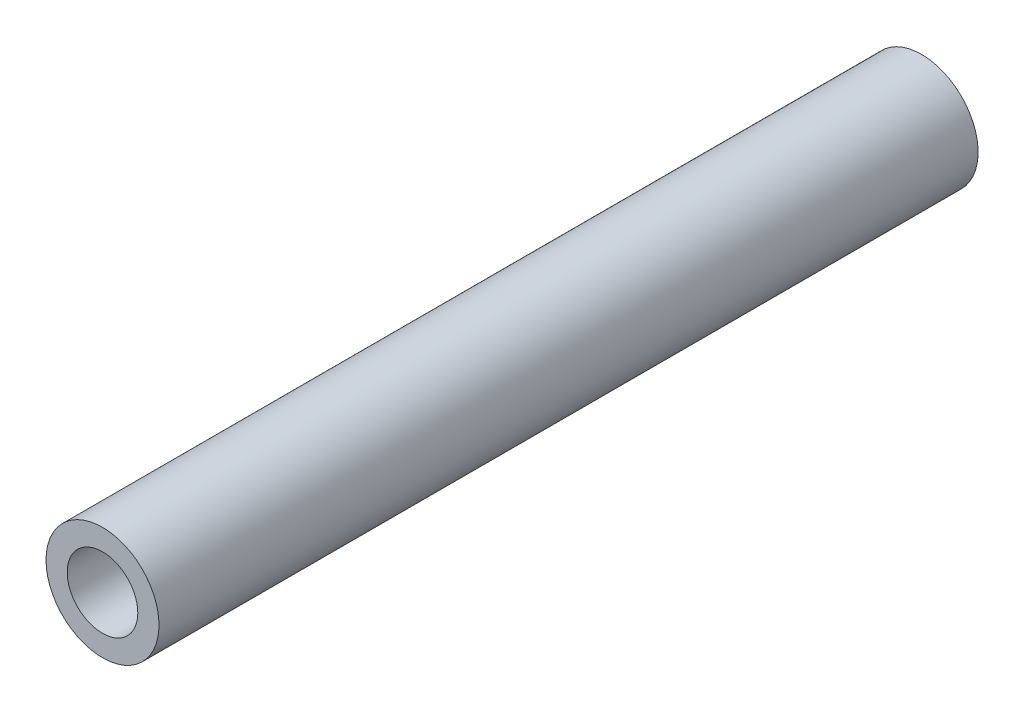
from build123d import *

# Parameters (mm, degrees)
SKETCH1_R           = 2
BOSS_EXTRUDE1_DEPTH = 29


with BuildPart() as part:
    # Sketch1 → Boss-Extrude1 (new body)
    with BuildSketch(Plane.XY):
        with Locations(Location((0, 0, 0), (0, 0, 180))):
            Circle(SKETCH1_R)
    extrude(amount=BOSS_EXTRUDE1_DEPTH)

    # Sketch6 → Tap Drill for M3x0.5 Tap1 (revolve, cut)
    with BuildSketch(Plane(origin=(0, 0, 29), x_dir=(0, -1, 0), z_dir=(1, 0, 0))):
        Polygon((0, 0), (0, 5.751075774), (1.25, 5), (1.25, 0), align=None)
    tap_drill_for_m3x0_5_tap1 = revolve(axis=Axis((0, 0, 35.35), (0, 0, -1)), mode=Mode.SUBTRACT)

    # Mirror2: Tap Drill for M3x0.5 Tap1 across plane
    add(tap_drill_for_m3x0_5_tap1.mirror(Plane(origin=(0, 0, 14.5), x_dir=(1, 0, 0), z_dir=(0, 0, -1))), mode=Mode.SUBTRACT)


solid = part.part
